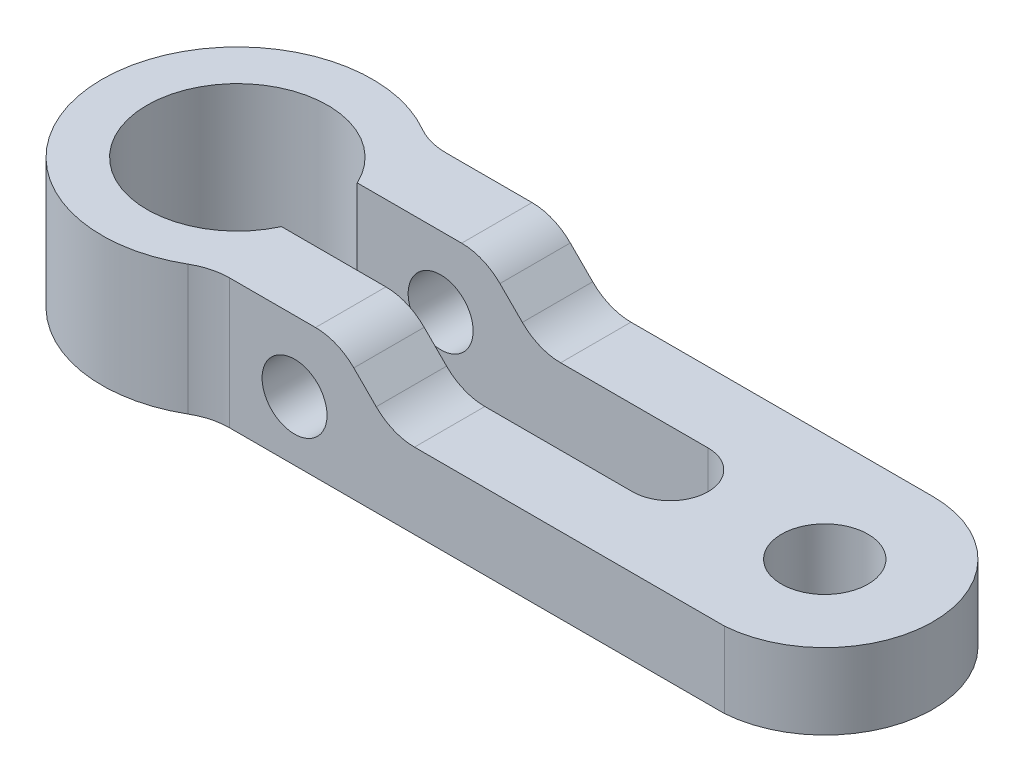
from build123d import *

# Parameters (mm, degrees)
SKETCH1_R               = 8.35
SKETCH1_R_2             = 4
BOSS_EXTRUDE1_DEPTH     = 12
CUT_EXTRUDE1_DEPTH      = 70.17162349
SKETCH4_R               = 3
CUT_EXTRUDE3_DEPTH      = 70.17162349
FILLET2_R               = 5
CUT_EXTRUDE4_DEPTH      = 67.593644564
CUT_EXTRUDE4_DEPTH_BACK = 67.593644564


with BuildPart() as part:
    # Sketch1 → Boss-Extrude1 (new body)
    with BuildSketch(Plane(origin=(0, 0, 0), x_dir=(1, 0, 0), z_dir=(0, 1, 0))):
        with BuildLine():
            Line((9.287087811, 10), (54.287087811, 10))
            ThreePointArc((54.287087811, 10), (64.293438841, 0.343976386), (55, -10))
            Line((55, -10), (9.287087811, -10))
            ThreePointArc((9.287087811, -10), (7.727462076, -10.20624754), (6.275059331, -10.810810811))
            ThreePointArc((6.275059331, -10.810810811), (-12.5, 0), (6.275059331, 10.810810811))
            ThreePointArc((6.275059331, 10.810810811), (7.727462076, 10.20624754), (9.287087811, 10))
        make_face()
        with Locations(Location((0, 0, 0), (0, 0, 270))):
            Circle(SKETCH1_R, mode=Mode.SUBTRACT)
        with Locations(Location((54.287087811, -0.012706095, 0), (0, 0, 270))):
            Circle(SKETCH1_R_2, mode=Mode.SUBTRACT)
    extrude(amount=BOSS_EXTRUDE1_DEPTH)

    # Sketch2 → Cut-Extrude1 (cut, through all)
    with BuildSketch(Plane.XY.offset(10)):
        Polygon((19.299793905, 12), (24.299793905, 7), (64.299793905, 7), (64.299793905, 12), align=None)
    extrude(amount=-CUT_EXTRUDE1_DEPTH, mode=Mode.SUBTRACT)

    # Sketch4 → Cut-Extrude3 (cut, through all)
    with BuildSketch(Plane.XY.offset(10)):
        with Locations((15.287087811, 5.5)):
            Circle(SKETCH4_R)
    extrude(amount=-CUT_EXTRUDE3_DEPTH, mode=Mode.SUBTRACT)

    # Fillet2
    fillet2_edges = [part.edges().sort_by_distance(p)[0] for p in [
        (24.299793905, 7, 0),
        (19.299793905, 12, 0),
    ]]
    fillet(fillet2_edges, radius=FILLET2_R)

    # Sketch5 → Cut-Extrude4 (cut, two sides: drawn at the far end of the back side and taken through both)
    with BuildSketch(Plane(origin=(0, 12, 0), x_dir=(1, 0, 0), z_dir=(0, 1, 0)).offset(-CUT_EXTRUDE4_DEPTH_BACK)):
        with BuildLine():
            Line((0, -3.5), (40, -3.5))
            ThreePointArc((40, -3.5), (43.5, 0), (40, 3.5))
            Line((40, 3.5), (0, 3.5))
            Line((0, 3.5), (0, -3.5))
        make_face()
    extrude(amount=CUT_EXTRUDE4_DEPTH + CUT_EXTRUDE4_DEPTH_BACK, mode=Mode.SUBTRACT)


solid = part.part
